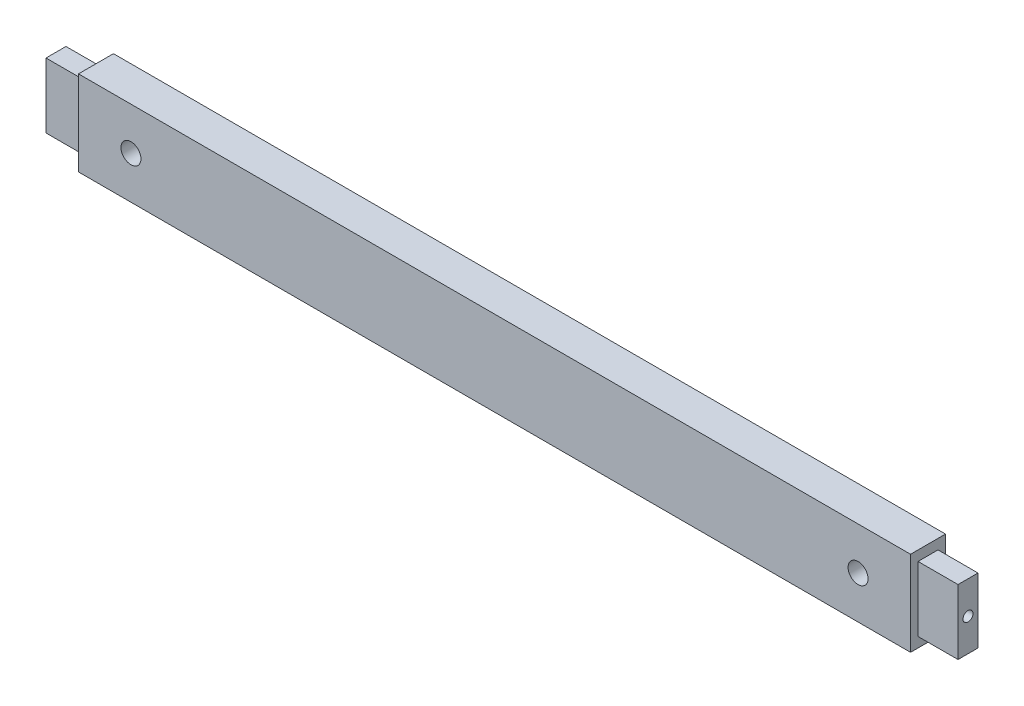
from build123d import *

# Parameters (mm, degrees)
SKETCH2_W           = 1057.275
SKETCH2_H           = 107.95
BOSS_EXTRUDE1_DEPTH = 22.225
SKETCH3_W           = 25.4
SKETCH3_H           = 82.55
BOSS_EXTRUDE2_DEPTH = 50.8
SKETCH4_R           = 6.35
CUT_EXTRUDE1_DEPTH  = 117.475
SKETCH5_W           = 3.175
SKETCH5_H           = 9.525
CUT_EXTRUDE2_DEPTH  = 1110.611399038
SKETCH6_R           = 12.7
CUT_EXTRUDE3_DEPTH  = 584.64108794


with BuildPart() as part:
    # Sketch2 → Boss-Extrude1 (new, symmetric)
    with BuildSketch(Plane.XY):
        Rectangle(SKETCH2_W, SKETCH2_H)
    extrude(amount=BOSS_EXTRUDE1_DEPTH, both=True)

    # Sketch3 → Boss-Extrude2 (add)
    with BuildSketch(Plane(origin=(528.6375, 0, 0), x_dir=(0, 0, -1), z_dir=(1, 0, 0))):
        Rectangle(SKETCH3_W, SKETCH3_H)
    boss_extrude2 = extrude(amount=BOSS_EXTRUDE2_DEPTH)

    # Sketch4 → Cut-Extrude1 (cut)
    with BuildSketch(Plane(origin=(579.4375, 0, 0), x_dir=(0, 0, -1), z_dir=(1, 0, 0))):
        Circle(SKETCH4_R)
    cut_extrude1 = extrude(amount=-CUT_EXTRUDE1_DEPTH, mode=Mode.SUBTRACT)

    # Mirror1: Boss-Extrude2, Cut-Extrude1 across plane
    add(boss_extrude2.mirror(Plane(origin=(0, 0, 0), x_dir=(0, 0, 1), z_dir=(1, 0, 0))))
    add(cut_extrude1.mirror(Plane(origin=(0, 0, 0), x_dir=(0, 0, 1), z_dir=(1, 0, 0))), mode=Mode.SUBTRACT)

    # Sketch5 → Cut-Extrude2 (cut, through all)
    with BuildSketch(Plane(origin=(528.6375, 0, 0), x_dir=(0, 0, -1), z_dir=(1, 0, 0))):
        with Locations((20.6375, 23.8125)):
            Rectangle(SKETCH5_W, SKETCH5_H)
    extrude(amount=-CUT_EXTRUDE2_DEPTH, mode=Mode.SUBTRACT)

    # Sketch6 → Cut-Extrude3 (cut, through all)
    with BuildSketch(Plane(origin=(0, 0, -22.225), x_dir=(-1, 0, 0), z_dir=(0, 0, -1))):
        with Locations((461.9625, 0)):
            Circle(SKETCH6_R)
        with Locations((-461.9625, 0)):
            Circle(SKETCH6_R)
    extrude(amount=-CUT_EXTRUDE3_DEPTH, mode=Mode.SUBTRACT)


solid = part.part
